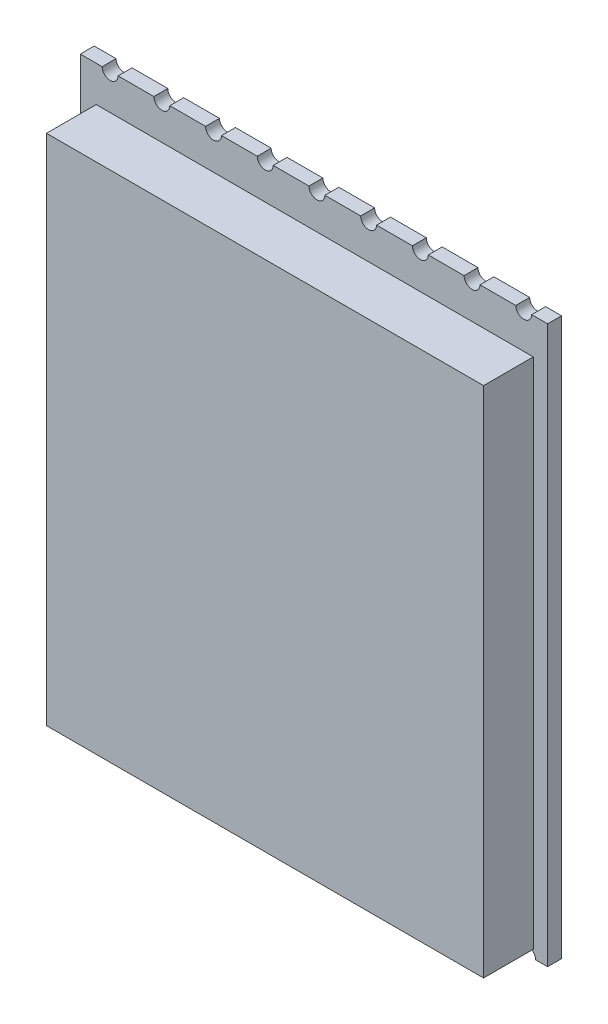
from build123d import *

# Parameters (mm, degrees)
SKETCH1_W           = 23.5
SKETCH1_H           = 28
BOSS_EXTRUDE1_DEPTH = 0.7
SKETCH2_W           = 21.98
SKETCH2_H           = 25.8
BOSS_EXTRUDE2_DEPTH = 2.5
SKETCH3_R           = 0.4
CUT_EXTRUDE1_DEPTH  = 2.5


with BuildPart() as part:
    # Sketch1 → Boss-Extrude1 (new body)
    with BuildSketch(Plane.XY):
        with Locations((11.75, 14)):
            Rectangle(SKETCH1_W, SKETCH1_H)
    extrude(amount=BOSS_EXTRUDE1_DEPTH)

    # Sketch2 → Boss-Extrude2 (add)
    with BuildSketch(Plane.XY.offset(0.7)):
        with Locations((11.79, 13.3)):
            Rectangle(SKETCH2_W, SKETCH2_H)
    extrude(amount=BOSS_EXTRUDE2_DEPTH)

    # Sketch3 → Cut-Extrude1 (cut)
    with BuildSketch(Plane.XY.offset(0.7)):
        with Locations((1.5, 28)):
            Circle(SKETCH3_R)
        with Locations((4.1, 28)):
            Circle(SKETCH3_R)
        with Locations((6.7, 28)):
            Circle(SKETCH3_R)
        with Locations((9.3, 28)):
            Circle(SKETCH3_R)
        with Locations((11.9, 28)):
            Circle(SKETCH3_R)
        with Locations((14.5, 28)):
            Circle(SKETCH3_R)
        with Locations((17.1, 28)):
            Circle(SKETCH3_R)
        with Locations((19.7, 28)):
            Circle(SKETCH3_R)
        with Locations((22.3, 28)):
            Circle(SKETCH3_R)
        with Locations((22.5, 0)):
            Circle(SKETCH3_R)
        with Locations((19.9, 0)):
            Circle(SKETCH3_R)
        with Locations((17.3, 0)):
            Circle(SKETCH3_R)
    extrude(amount=-CUT_EXTRUDE1_DEPTH, mode=Mode.SUBTRACT)


solid = part.part
